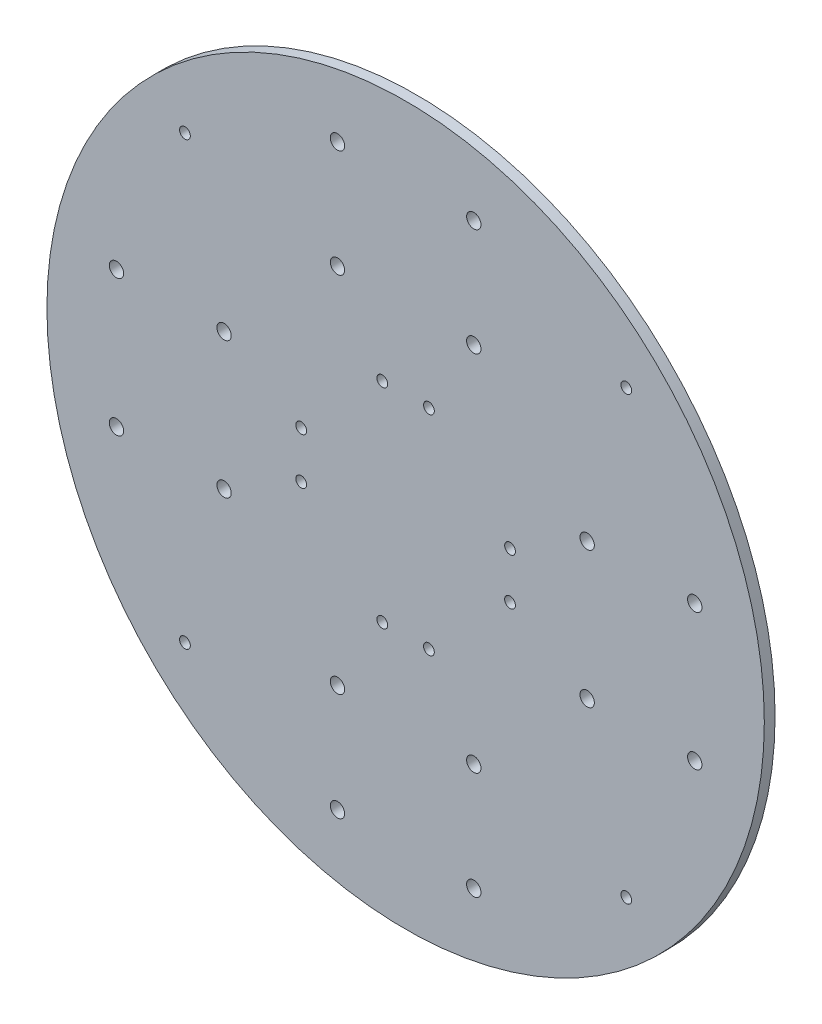
from build123d import *

# Parameters (mm, degrees)
CROQUIS1_R              = 100
CROQUIS1_R_2            = 2
SALIENTE_EXTRUIR1_DEPTH = 3
CORTAR_EXTRUIR2_START   = -3
CROQUIS2_R              = 2
CROQUIS2_R_2            = 1.5
CORTAR_EXTRUIR2_DEPTH   = 3
CROQUIS4_R              = 1.5
CORTAR_EXTRUIR3_DEPTH   = 3


with BuildPart() as part:
    # Croquis1 → Saliente-Extruir1 (new body)
    with BuildSketch(Plane.XY):
        Circle(CROQUIS1_R)
        with Locations((-50.610307618, 19)):
            Circle(CROQUIS1_R_2, mode=Mode.SUBTRACT)
        with Locations((-50.610307618, -19)):
            Circle(CROQUIS1_R_2, mode=Mode.SUBTRACT)
        with Locations((-80.610307618, 19)):
            Circle(CROQUIS1_R_2, mode=Mode.SUBTRACT)
        with Locations((-80.610307618, -19)):
            Circle(CROQUIS1_R_2, mode=Mode.SUBTRACT)
        with Locations((-19, -50.610307618)):
            Circle(CROQUIS1_R_2, mode=Mode.SUBTRACT)
        with Locations((19, -50.610307618)):
            Circle(CROQUIS1_R_2, mode=Mode.SUBTRACT)
        with Locations((-19, -80.610307618)):
            Circle(CROQUIS1_R_2, mode=Mode.SUBTRACT)
        with Locations((19, -80.610307618)):
            Circle(CROQUIS1_R_2, mode=Mode.SUBTRACT)
        with Locations((50.610307618, -19)):
            Circle(CROQUIS1_R_2, mode=Mode.SUBTRACT)
        with Locations((50.610307618, 19)):
            Circle(CROQUIS1_R_2, mode=Mode.SUBTRACT)
        with Locations((80.610307618, -19)):
            Circle(CROQUIS1_R_2, mode=Mode.SUBTRACT)
        with Locations((80.610307618, 19)):
            Circle(CROQUIS1_R_2, mode=Mode.SUBTRACT)
        with Locations((19, 50.610307618)):
            Circle(CROQUIS1_R_2, mode=Mode.SUBTRACT)
        with Locations((-19, 50.610307618)):
            Circle(CROQUIS1_R_2, mode=Mode.SUBTRACT)
        with Locations((19, 80.610307618)):
            Circle(CROQUIS1_R_2, mode=Mode.SUBTRACT)
        with Locations((-19, 80.610307618)):
            Circle(CROQUIS1_R_2, mode=Mode.SUBTRACT)
    extrude(amount=SALIENTE_EXTRUIR1_DEPTH)

    # Croquis2 → Cortar-Extruir2 (cut)
    with BuildSketch(Plane.XY.offset(3).offset(CORTAR_EXTRUIR2_START)):
        with Locations((19, 80.610307618)):
            Circle(CROQUIS2_R)
        with Locations((19, 50.610307618)):
            Circle(CROQUIS2_R)
        with Locations((-19, 50.610307618)):
            Circle(CROQUIS2_R)
        with Locations((-19, 80.610307618)):
            Circle(CROQUIS2_R)
        with Locations((-6.5, 29.110307618)):
            Circle(CROQUIS2_R_2)
        with Locations((6.5, 29.110307618)):
            Circle(CROQUIS2_R_2)
        with Locations((29.110307618, 6.5)):
            Circle(CROQUIS2_R_2)
        with Locations((29.110307618, -6.5)):
            Circle(CROQUIS2_R_2)
        with Locations((6.5, -29.110307618)):
            Circle(CROQUIS2_R_2)
        with Locations((-6.5, -29.110307618)):
            Circle(CROQUIS2_R_2)
        with Locations((-29.110307618, -6.5)):
            Circle(CROQUIS2_R_2)
        with Locations((-29.110307618, 6.5)):
            Circle(CROQUIS2_R_2)
    extrude(amount=CORTAR_EXTRUIR2_DEPTH, mode=Mode.SUBTRACT)

    # Croquis4 → Cortar-Extruir3 (cut)
    with BuildSketch(Plane.XY.offset(3)):
        with Locations((-61.518289963, 61.518289963)):
            Circle(CROQUIS4_R)
        with Locations((61.518289963, 61.518289963)):
            Circle(CROQUIS4_R)
        with Locations((61.518289963, -61.518289963)):
            Circle(CROQUIS4_R)
        with Locations((-61.518289963, -61.518289963)):
            Circle(CROQUIS4_R)
    extrude(amount=-CORTAR_EXTRUIR3_DEPTH, mode=Mode.SUBTRACT)


solid = part.part
